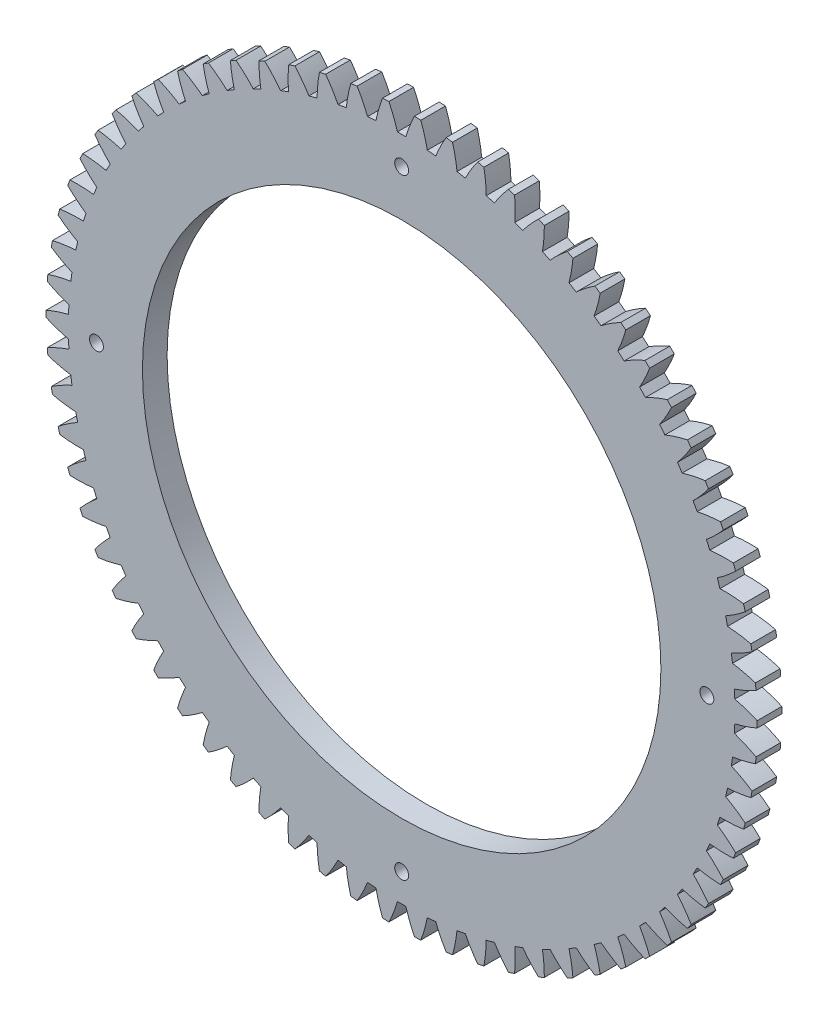
from build123d import *

# Parameters (mm, degrees)
SKETCH1_R           = 1.7859375
SKETCH1_R_2         = 66.675
BOSS_EXTRUDE1_DEPTH = 6.35


with BuildPart() as part:
    # Sketch1 → Boss-Extrude1 (new body)
    with BuildSketch(Plane.XY):
        with BuildLine():
            ThreePointArc((-91.436313371, -0.821095041), (-88.599272387, -1.913246534), (-85.679316616, -2.759092107))
            ThreePointArc((-85.679316616, -2.759092107), (-85.637411908, -3.845980603), (-85.581719987, -4.932249915))
            ThreePointArc((-85.581719987, -4.932249915), (-88.414099861, -6.03643318), (-91.141820048, -7.378498385))
            ThreePointArc((-91.141820048, -7.378498385), (-91.071889443, -8.196618406), (-90.994615263, -9.014077493))
            ThreePointArc((-90.994615263, -9.014077493), (-88.071095667, -9.847521912), (-85.087073767, -10.428219542))
            ThreePointArc((-85.087073767, -10.428219542), (-84.947909821, -11.506976236), (-84.795069669, -12.583880362))
            ThreePointArc((-84.795069669, -12.583880362), (-87.51706899, -13.937511083), (-90.113506379, -15.518684481))
            ThreePointArc((-90.113506379, -15.518684481), (-89.970521581, -16.32724246), (-89.820282017, -17.134483894))
            ThreePointArc((-89.820282017, -17.134483894), (-86.833822269, -17.702510834), (-83.809759831, -18.013385085))
            ThreePointArc((-83.809759831, -18.013385085), (-83.574457113, -19.075324462), (-83.325699309, -20.134192802))
            ThreePointArc((-83.325699309, -20.134192802), (-85.915402138, -21.726372343), (-88.359651744, -23.533923255))
            ThreePointArc((-88.359651744, -23.533923255), (-88.144763982, -24.326409159), (-87.922768674, -25.116933505))
            ThreePointArc((-87.922768674, -25.116933505), (-84.897413993, -25.414969548), (-81.857658987, -25.453517444))
            ThreePointArc((-81.857658987, -25.453517444), (-81.528112018, -26.490089391), (-81.185439413, -27.522396561))
            ThreePointArc((-81.185439413, -27.522396561), (-83.621994986, -29.340305627), (-85.894377147, -31.359680716))
            ThreePointArc((-85.894377147, -31.359680716), (-85.609316571, -32.129713914), (-85.317352895, -32.897156335))
            ThreePointArc((-85.317352895, -32.897156335), (-82.277461657, -32.92280187), (-79.246488405, -32.688713046))
            ThreePointArc((-79.246488405, -32.688713046), (-78.825350502, -33.691571697), (-78.391522095, -34.689006166))
            ThreePointArc((-78.391522095, -34.689006166), (-80.655312699, -36.718008022), (-82.73753153, -38.932948467))
            ThreePointArc((-82.73753153, -38.932948467), (-82.384593281, -39.674329105), (-82.025011957, -40.412510607))
            ThreePointArc((-82.025011957, -40.412510607), (-78.995059579, -40.16555915), (-75.997271695, -39.660718351))
            ThreePointArc((-75.997271695, -39.660718351), (-75.487933612, -40.621789277), (-74.966442334, -41.57632029))
            ThreePointArc((-74.966442334, -41.57632029), (-77.039241259, -43.800078607), (-78.914531958, -46.192751009))
            ThreePointArc((-78.914531958, -46.192751009), (-78.496557687, -46.899509926), (-78.072253852, -47.602487105))
            ThreePointArc((-78.072253852, -47.602487105), (-75.076635729, -47.084926965), (-72.136169638, -46.313398872))
            ThreePointArc((-72.136169638, -46.313398872), (-71.542732267, -47.224944096), (-70.937776859, -48.12888633))
            ThreePointArc((-70.937776859, -48.12888633), (-72.802895147, -50.529496712), (-74.456158976, -53.080636681))
            ThreePointArc((-74.456158976, -53.080636681), (-73.976513966, -53.74708347), (-73.490903864, -54.409196366))
            ThreePointArc((-73.490903864, -54.409196366), (-70.553738953, -53.625194633), (-67.694269559, -52.593191137))
            ThreePointArc((-67.694269559, -52.593191137), (-67.021510909, -53.447871432), (-66.337962116, -54.293946876))
            ThreePointArc((-66.337962116, -54.293946876), (-67.98038293, -56.852081021), (-69.398308782, -59.541148278))
            ThreePointArc((-69.398308782, -59.541148278), (-68.860854851, -60.1619171), (-68.317848331, -60.777834771))
            ThreePointArc((-68.317848331, -60.777834771), (-65.462784956, -59.733703766), (-62.707335025, -58.449533952))
            ThreePointArc((-62.707335025, -58.449533952), (-61.960671752, -59.240467935), (-61.204033108, -60.021864486))
            ThreePointArc((-61.204033108, -60.021864486), (-62.610532642, -62.716925802), (-63.781704211, -65.522269558))
            ThreePointArc((-63.781704211, -65.522269558), (-63.190768623, -66.092362348), (-62.594737653, -66.657125786))
            ThreePointArc((-62.594737653, -66.657125786), (-59.844763106, -65.361272238), (-57.2155179, -63.835275487))
            ThreePointArc((-57.2155179, -63.835275487), (-56.400961699, -64.556095022), (-55.577325213, -65.266521336))
            ThreePointArc((-55.577325213, -65.266521336), (-56.736579159, -68.076810773), (-57.65156686, -70.97584405))
            ThreePointArc((-57.65156686, -70.97584405), (-57.011907482, -71.490670757), (-56.367650953, -71.999732819))
            ThreePointArc((-56.367650953, -71.999732819), (-53.744906411, -70.462590178), (-51.263035068, -68.707052918))
            ThreePointArc((-51.263035068, -68.707052918), (-50.387144266, -69.351954391), (-49.503141374, -69.985690532))
            ThreePointArc((-49.503141374, -69.985690532), (-50.405816102, -72.888581292), (-51.057252992, -75.857962779))
            ThreePointArc((-51.057252992, -75.857962779), (-50.374019984, -76.31337832), (-49.686725071, -76.762640338))
            ThreePointArc((-49.686725071, -76.762640338), (-47.212327331, -74.996584773), (-44.89781242, -73.025641559))
            ThreePointArc((-44.89781242, -73.025641559), (-43.967639174, -73.589432602), (-43.030387348, -74.141376098))
            ThreePointArc((-43.030387348, -74.141376098), (-43.669215051, -77.113495813), (-44.051856143, -80.129317795))
            ThreePointArc((-44.051856143, -80.129317795), (-43.330550497, -80.521655433), (-42.605750894, -80.907500213))
            ThreePointArc((-42.605750894, -80.907500213), (-40.299622352, -78.926750966), (-38.171098985, -76.756270671))
            ThreePointArc((-38.171098985, -76.756270671), (-37.194132504, -77.23441197), (-36.211177945, -77.700118899))
            ThreePointArc((-36.211177945, -77.700118899), (-36.581015158, -80.717537808), (-36.691779652, -83.75551866))
            ThreePointArc((-36.691779652, -83.75551866), (-35.938208894, -84.081619522), (-35.181740263, -84.400940469))
            ThreePointArc((-35.181740263, -84.400940469), (-33.06244851, -82.221445367), (-31.137054306, -79.868903425))
            ThreePointArc((-31.137054306, -79.868903425), (-30.121160548, -80.257545267), (-29.100417429, -80.63326603))
            ThreePointArc((-29.100417429, -80.63326603), (-29.19828644, -83.671689649), (-29.036282524, -86.707369336))
            ThreePointArc((-29.036282524, -86.707369336), (-28.256513966, -86.96460785), (-27.474466945, -87.21483398))
            ThreePointArc((-27.474466945, -87.21483398), (-25.559075273, -84.854141036), (-23.852312373, -82.33847873))
            ThreePointArc((-23.852312373, -82.33847873), (-22.805670719, -82.634492), (-21.755357462, -82.917201513))
            ThreePointArc((-21.755357462, -82.917201513), (-21.580470288, -85.952166243), (-21.147002323, -88.961103257))
            ThreePointArc((-21.147002323, -88.961103257), (-20.347314201, -89.14740829), (-19.545985374, -89.326524928))
            ThreePointArc((-19.545985374, -89.326524928), (-17.84991539, -86.803641054), (-16.375525647, -84.145113019))
            ThreePointArc((-16.375525647, -84.145113019), (-15.306563039, -84.346114392), (-14.235136149, -84.533536445))
            ThreePointArc((-14.235136149, -84.533536445), (-13.788900879, -87.540606534), (-13.087458894, -90.498574683))
            ThreePointArc((-13.087458894, -90.498574683), (-12.274289826, -90.612446216), (-11.460131023, -90.719011221))
            ThreePointArc((-11.460131023, -90.719011221), (-9.997038484, -88.054249195), (-8.766892816, -85.274260334))
            ThreePointArc((-8.766892816, -85.274260334), (-7.684215914, -85.378631465), (-6.60030189, -85.469257046))
            ThreePointArc((-6.60030189, -85.469257046), (-5.886311347, -88.424221334), (-4.922542941, -91.307404798))
            ThreePointArc((-4.922542941, -91.307404798), (-4.102440087, -91.347926005), (-3.282006434, -91.381081378))
            ThreePointArc((-3.282006434, -91.381081378), (-2.063671302, -88.595896296), (-1.08767412, -85.716829445))
            ThreePointArc((-1.08767412, -85.716829445), (0, -85.72373), (1.08767412, -85.716829445))
            ThreePointArc((1.08767412, -85.716829445), (2.063671302, -88.595896296), (3.282006434, -91.381081378))
            ThreePointArc((3.282006434, -91.381081378), (4.102440087, -91.347926005), (4.922542941, -91.307404798))
            ThreePointArc((4.922542941, -91.307404798), (5.886311347, -88.424221334), (6.60030189, -85.469257046))
            ThreePointArc((6.60030189, -85.469257046), (7.684215914, -85.378631465), (8.766892816, -85.274260334))
            ThreePointArc((8.766892816, -85.274260334), (9.997038484, -88.054249195), (11.460131023, -90.719011221))
            ThreePointArc((11.460131023, -90.719011221), (12.274289826, -90.612446216), (13.087458894, -90.498574683))
            ThreePointArc((13.087458894, -90.498574683), (13.788900879, -87.540606534), (14.235136149, -84.533536445))
            ThreePointArc((14.235136149, -84.533536445), (15.306563039, -84.346114392), (16.375525647, -84.145113019))
            ThreePointArc((16.375525647, -84.145113019), (17.84991539, -86.803641054), (19.545985375, -89.326524928))
            ThreePointArc((19.545985375, -89.326524928), (20.347314201, -89.14740829), (21.147002323, -88.961103257))
            ThreePointArc((21.147002323, -88.961103257), (21.580470288, -85.952166243), (21.755357462, -82.917201513))
            ThreePointArc((21.755357462, -82.917201513), (22.805670719, -82.634492), (23.852312373, -82.33847873))
            ThreePointArc((23.852312373, -82.33847873), (25.559075273, -84.854141036), (27.474466945, -87.21483398))
            ThreePointArc((27.474466945, -87.21483398), (28.256513966, -86.96460785), (29.036282524, -86.707369336))
            ThreePointArc((29.036282524, -86.707369336), (29.19828644, -83.671689649), (29.100417429, -80.63326603))
            ThreePointArc((29.100417429, -80.63326603), (30.121160548, -80.257545267), (31.137054306, -79.868903425))
            ThreePointArc((31.137054306, -79.868903425), (33.06244851, -82.221445367), (35.181740263, -84.400940469))
            ThreePointArc((35.181740263, -84.400940469), (35.938208894, -84.081619522), (36.691779652, -83.75551866))
            ThreePointArc((36.691779652, -83.75551866), (36.581015158, -80.717537808), (36.211177945, -77.700118899))
            ThreePointArc((36.211177945, -77.700118899), (37.194132504, -77.23441197), (38.171098985, -76.756270671))
            ThreePointArc((38.171098985, -76.756270671), (40.299622352, -78.926750966), (42.605750894, -80.907500213))
            ThreePointArc((42.605750894, -80.907500213), (43.330550497, -80.521655433), (44.051856143, -80.129317795))
            ThreePointArc((44.051856143, -80.129317795), (43.669215051, -77.113495813), (43.030387348, -74.141376098))
            ThreePointArc((43.030387348, -74.141376098), (43.967639174, -73.589432602), (44.89781242, -73.025641559))
            ThreePointArc((44.89781242, -73.025641559), (47.212327331, -74.996584773), (49.686725071, -76.762640338))
            ThreePointArc((49.686725071, -76.762640338), (50.374019984, -76.31337832), (51.057252992, -75.857962779))
            ThreePointArc((51.057252992, -75.857962779), (50.405816102, -72.888581292), (49.503141374, -69.985690532))
            ThreePointArc((49.503141374, -69.985690532), (50.387144266, -69.351954391), (51.263035068, -68.707052918))
            ThreePointArc((51.263035068, -68.707052918), (53.744906411, -70.462590178), (56.367650953, -71.999732819))
            ThreePointArc((56.367650953, -71.999732819), (57.011907482, -71.490670757), (57.65156686, -70.97584405))
            ThreePointArc((57.65156686, -70.97584405), (56.736579159, -68.076810773), (55.577325213, -65.266521336))
            ThreePointArc((55.577325213, -65.266521336), (56.400961699, -64.556095022), (57.2155179, -63.835275487))
            ThreePointArc((57.2155179, -63.835275487), (59.844763106, -65.361272238), (62.594737653, -66.657125786))
            ThreePointArc((62.594737653, -66.657125786), (63.190768623, -66.092362348), (63.781704211, -65.522269558))
            ThreePointArc((63.781704211, -65.522269558), (62.610532642, -62.716925802), (61.204033108, -60.021864486))
            ThreePointArc((61.204033108, -60.021864486), (61.960671752, -59.240467935), (62.707335025, -58.449533952))
            ThreePointArc((62.707335025, -58.449533952), (65.462784956, -59.733703766), (68.317848331, -60.777834771))
            ThreePointArc((68.317848331, -60.777834771), (68.860854851, -60.1619171), (69.398308782, -59.541148278))
            ThreePointArc((69.398308782, -59.541148278), (67.98038293, -56.852081021), (66.337962116, -54.293946876))
            ThreePointArc((66.337962116, -54.293946876), (67.021510909, -53.447871432), (67.694269559, -52.593191137))
            ThreePointArc((67.694269559, -52.593191137), (70.553738953, -53.625194633), (73.490903864, -54.409196366))
            ThreePointArc((73.490903864, -54.409196366), (73.976513966, -53.74708347), (74.456158976, -53.080636681))
            ThreePointArc((74.456158976, -53.080636681), (72.802895147, -50.529496712), (70.937776859, -48.12888633))
            ThreePointArc((70.937776859, -48.12888633), (71.542732267, -47.224944096), (72.136169638, -46.313398872))
            ThreePointArc((72.136169638, -46.313398872), (75.076635729, -47.084926965), (78.072253852, -47.602487105))
            ThreePointArc((78.072253852, -47.602487105), (78.496557687, -46.899509926), (78.914531958, -46.192751009))
            ThreePointArc((78.914531958, -46.192751009), (77.039241259, -43.800078607), (74.966442334, -41.57632029))
            ThreePointArc((74.966442334, -41.57632029), (75.487933612, -40.621789277), (75.997271695, -39.660718351))
            ThreePointArc((75.997271695, -39.660718351), (78.995059579, -40.16555915), (82.025011957, -40.412510607))
            ThreePointArc((82.025011957, -40.412510607), (82.384593281, -39.674329105), (82.73753153, -38.932948467))
            ThreePointArc((82.73753153, -38.932948467), (80.655312699, -36.718008022), (78.391522095, -34.689006166))
            ThreePointArc((78.391522095, -34.689006166), (78.825350502, -33.691571697), (79.246488405, -32.688713046))
            ThreePointArc((79.246488405, -32.688713046), (82.277461657, -32.92280187), (85.317352895, -32.897156335))
            ThreePointArc((85.317352895, -32.897156335), (85.609316571, -32.129713914), (85.894377147, -31.359680716))
            ThreePointArc((85.894377147, -31.359680716), (83.621994986, -29.340305627), (81.185439413, -27.522396561))
            ThreePointArc((81.185439413, -27.522396561), (81.528112018, -26.490089391), (81.857658987, -25.453517444))
            ThreePointArc((81.857658987, -25.453517444), (84.897413993, -25.414969548), (87.922768674, -25.116933505))
            ThreePointArc((87.922768674, -25.116933505), (88.144763982, -24.326409159), (88.359651744, -23.533923255))
            ThreePointArc((88.359651744, -23.533923255), (85.915402138, -21.726372343), (83.325699309, -20.134192802))
            ThreePointArc((83.325699309, -20.134192802), (83.574457113, -19.075324462), (83.809759831, -18.013385085))
            ThreePointArc((83.809759831, -18.013385085), (86.833822269, -17.702510834), (89.820282017, -17.134483894))
            ThreePointArc((89.820282017, -17.134483894), (89.970521581, -16.32724246), (90.113506379, -15.518684481))
            ThreePointArc((90.113506379, -15.518684481), (87.51706899, -13.937511083), (84.795069669, -12.583880362))
            ThreePointArc((84.795069669, -12.583880362), (84.947909821, -11.506976236), (85.087073767, -10.428219542))
            ThreePointArc((85.087073767, -10.428219542), (88.071095667, -9.847521912), (90.994615263, -9.014077493))
            ThreePointArc((90.994615263, -9.014077493), (91.071889443, -8.196618406), (91.141820048, -7.378498385))
            ThreePointArc((91.141820048, -7.378498385), (88.414099861, -6.03643318), (85.581719987, -4.932249915))
            ThreePointArc((85.581719987, -4.932249915), (85.637411908, -3.845980603), (85.679316616, -2.759092107))
            ThreePointArc((85.679316616, -2.759092107), (88.599272387, -1.913246534), (91.436313371, -0.821095041))
            ThreePointArc((91.436313371, -0.821095041), (91.44, 0), (91.436313371, 0.821095041))
            ThreePointArc((91.436313371, 0.821095041), (88.599272387, 1.913246534), (85.679316616, 2.759092107))
            ThreePointArc((85.679316616, 2.759092107), (85.637411908, 3.845980603), (85.581719987, 4.932249915))
            ThreePointArc((85.581719987, 4.932249915), (88.414099861, 6.03643318), (91.141820048, 7.378498385))
            ThreePointArc((91.141820048, 7.378498385), (91.071889443, 8.196618406), (90.994615263, 9.014077493))
            ThreePointArc((90.994615263, 9.014077493), (88.071095667, 9.847521912), (85.087073767, 10.428219542))
            ThreePointArc((85.087073767, 10.428219542), (84.947909821, 11.506976236), (84.795069669, 12.583880362))
            ThreePointArc((84.795069669, 12.583880362), (87.51706899, 13.937511083), (90.113506379, 15.518684481))
            ThreePointArc((90.113506379, 15.518684481), (89.970521581, 16.32724246), (89.820282017, 17.134483894))
            ThreePointArc((89.820282017, 17.134483894), (86.833822269, 17.702510834), (83.809759831, 18.013385085))
            ThreePointArc((83.809759831, 18.013385085), (83.574457113, 19.075324462), (83.325699309, 20.134192802))
            ThreePointArc((83.325699309, 20.134192802), (85.915402138, 21.726372343), (88.359651744, 23.533923255))
            ThreePointArc((88.359651744, 23.533923255), (88.144763982, 24.326409159), (87.922768674, 25.116933505))
            ThreePointArc((87.922768674, 25.116933505), (84.897413993, 25.414969548), (81.857658987, 25.453517444))
            ThreePointArc((81.857658987, 25.453517444), (81.528112018, 26.490089391), (81.185439413, 27.522396561))
            ThreePointArc((81.185439413, 27.522396561), (83.621994986, 29.340305627), (85.894377147, 31.359680716))
            ThreePointArc((85.894377147, 31.359680716), (85.609316571, 32.129713914), (85.317352895, 32.897156335))
            ThreePointArc((85.317352895, 32.897156335), (82.277461657, 32.92280187), (79.246488405, 32.688713046))
            ThreePointArc((79.246488405, 32.688713046), (78.825350502, 33.691571697), (78.391522095, 34.689006166))
            ThreePointArc((78.391522095, 34.689006166), (80.655312699, 36.718008022), (82.73753153, 38.932948467))
            ThreePointArc((82.73753153, 38.932948467), (82.384593281, 39.674329105), (82.025011957, 40.412510607))
            ThreePointArc((82.025011957, 40.412510607), (78.995059579, 40.16555915), (75.997271695, 39.660718351))
            ThreePointArc((75.997271695, 39.660718351), (75.487933612, 40.621789277), (74.966442334, 41.57632029))
            ThreePointArc((74.966442334, 41.57632029), (77.039241259, 43.800078607), (78.914531958, 46.192751009))
            ThreePointArc((78.914531958, 46.192751009), (78.496557687, 46.899509926), (78.072253852, 47.602487105))
            ThreePointArc((78.072253852, 47.602487105), (75.076635729, 47.084926965), (72.136169638, 46.313398872))
            ThreePointArc((72.136169638, 46.313398872), (71.542732267, 47.224944096), (70.937776859, 48.12888633))
            ThreePointArc((70.937776859, 48.12888633), (72.802895147, 50.529496712), (74.456158976, 53.080636681))
            ThreePointArc((74.456158976, 53.080636681), (73.976513966, 53.74708347), (73.490903864, 54.409196366))
            ThreePointArc((73.490903864, 54.409196366), (70.553738953, 53.625194633), (67.694269559, 52.593191137))
            ThreePointArc((67.694269559, 52.593191137), (67.021510909, 53.447871432), (66.337962116, 54.293946876))
            ThreePointArc((66.337962116, 54.293946876), (67.98038293, 56.852081021), (69.398308782, 59.541148278))
            ThreePointArc((69.398308782, 59.541148278), (68.860854851, 60.1619171), (68.317848331, 60.777834771))
            ThreePointArc((68.317848331, 60.777834771), (65.462784956, 59.733703766), (62.707335025, 58.449533952))
            ThreePointArc((62.707335025, 58.449533952), (61.960671752, 59.240467935), (61.204033108, 60.021864486))
            ThreePointArc((61.204033108, 60.021864486), (62.610532642, 62.716925802), (63.781704211, 65.522269558))
            ThreePointArc((63.781704211, 65.522269558), (63.190768623, 66.092362348), (62.594737653, 66.657125786))
            ThreePointArc((62.594737653, 66.657125786), (59.844763106, 65.361272238), (57.2155179, 63.835275487))
            ThreePointArc((57.2155179, 63.835275487), (56.400961699, 64.556095022), (55.577325213, 65.266521336))
            ThreePointArc((55.577325213, 65.266521336), (56.736579159, 68.076810773), (57.65156686, 70.97584405))
            ThreePointArc((57.65156686, 70.97584405), (57.011907482, 71.490670757), (56.367650953, 71.999732819))
            ThreePointArc((56.367650953, 71.999732819), (53.744906411, 70.462590178), (51.263035068, 68.707052918))
            ThreePointArc((51.263035068, 68.707052918), (50.387144266, 69.351954391), (49.503141374, 69.985690532))
            ThreePointArc((49.503141374, 69.985690532), (50.405816102, 72.888581292), (51.057252992, 75.857962779))
            ThreePointArc((51.057252992, 75.857962779), (50.374019984, 76.31337832), (49.686725071, 76.762640338))
            ThreePointArc((49.686725071, 76.762640338), (47.212327331, 74.996584773), (44.89781242, 73.025641559))
            ThreePointArc((44.89781242, 73.025641559), (43.967639174, 73.589432602), (43.030387348, 74.141376098))
            ThreePointArc((43.030387348, 74.141376098), (43.669215051, 77.113495813), (44.051856143, 80.129317795))
            ThreePointArc((44.051856143, 80.129317795), (43.330550497, 80.521655433), (42.605750894, 80.907500213))
            ThreePointArc((42.605750894, 80.907500213), (40.299622352, 78.926750966), (38.171098985, 76.756270671))
            ThreePointArc((38.171098985, 76.756270671), (37.194132504, 77.23441197), (36.211177945, 77.700118899))
            ThreePointArc((36.211177945, 77.700118899), (36.581015158, 80.717537808), (36.691779652, 83.75551866))
            ThreePointArc((36.691779652, 83.75551866), (35.938208894, 84.081619522), (35.181740263, 84.400940469))
            ThreePointArc((35.181740263, 84.400940469), (33.06244851, 82.221445367), (31.137054306, 79.868903425))
            ThreePointArc((31.137054306, 79.868903425), (30.121160548, 80.257545267), (29.100417429, 80.63326603))
            ThreePointArc((29.100417429, 80.63326603), (29.19828644, 83.671689649), (29.036282524, 86.707369336))
            ThreePointArc((29.036282524, 86.707369336), (28.256513966, 86.96460785), (27.474466945, 87.21483398))
            ThreePointArc((27.474466945, 87.21483398), (25.559075273, 84.854141036), (23.852312373, 82.33847873))
            ThreePointArc((23.852312373, 82.33847873), (22.805670719, 82.634492), (21.755357462, 82.917201513))
            ThreePointArc((21.755357462, 82.917201513), (21.580470288, 85.952166243), (21.147002323, 88.961103257))
            ThreePointArc((21.147002323, 88.961103257), (20.347314201, 89.14740829), (19.545985374, 89.326524928))
            ThreePointArc((19.545985374, 89.326524928), (17.84991539, 86.803641054), (16.375525647, 84.145113019))
            ThreePointArc((16.375525647, 84.145113019), (15.306563039, 84.346114392), (14.235136149, 84.533536445))
            ThreePointArc((14.235136149, 84.533536445), (13.788900879, 87.540606534), (13.087458894, 90.498574683))
            ThreePointArc((13.087458894, 90.498574683), (12.274289826, 90.612446216), (11.460131023, 90.719011221))
            ThreePointArc((11.460131023, 90.719011221), (9.997038484, 88.054249195), (8.766892816, 85.274260334))
            ThreePointArc((8.766892816, 85.274260334), (7.684215914, 85.378631465), (6.60030189, 85.469257046))
            ThreePointArc((6.60030189, 85.469257046), (5.886311347, 88.424221334), (4.922542941, 91.307404798))
            ThreePointArc((4.922542941, 91.307404798), (4.102440087, 91.347926005), (3.282006434, 91.381081378))
            ThreePointArc((3.282006434, 91.381081378), (2.063671302, 88.595896296), (1.08767412, 85.716829445))
            ThreePointArc((1.08767412, 85.716829445), (0, 85.72373), (-1.08767412, 85.716829445))
            ThreePointArc((-1.08767412, 85.716829445), (-2.063671302, 88.595896296), (-3.282006434, 91.381081378))
            ThreePointArc((-3.282006434, 91.381081378), (-4.102440087, 91.347926005), (-4.922542941, 91.307404798))
            ThreePointArc((-4.922542941, 91.307404798), (-5.886311347, 88.424221334), (-6.60030189, 85.469257046))
            ThreePointArc((-6.60030189, 85.469257046), (-7.684215914, 85.378631465), (-8.766892816, 85.274260334))
            ThreePointArc((-8.766892816, 85.274260334), (-9.997038484, 88.054249195), (-11.460131023, 90.719011221))
            ThreePointArc((-11.460131023, 90.719011221), (-12.274289826, 90.612446216), (-13.087458894, 90.498574683))
            ThreePointArc((-13.087458894, 90.498574683), (-13.788900879, 87.540606534), (-14.235136149, 84.533536445))
            ThreePointArc((-14.235136149, 84.533536445), (-15.306563039, 84.346114392), (-16.375525647, 84.145113019))
            ThreePointArc((-16.375525647, 84.145113019), (-17.84991539, 86.803641054), (-19.545985375, 89.326524928))
            ThreePointArc((-19.545985375, 89.326524928), (-20.347314201, 89.14740829), (-21.147002323, 88.961103257))
            ThreePointArc((-21.147002323, 88.961103257), (-21.580470288, 85.952166243), (-21.755357462, 82.917201513))
            ThreePointArc((-21.755357462, 82.917201513), (-22.805670719, 82.634492), (-23.852312373, 82.33847873))
            ThreePointArc((-23.852312373, 82.33847873), (-25.559075273, 84.854141036), (-27.474466945, 87.21483398))
            ThreePointArc((-27.474466945, 87.21483398), (-28.256513966, 86.96460785), (-29.036282524, 86.707369336))
            ThreePointArc((-29.036282524, 86.707369336), (-29.19828644, 83.671689649), (-29.100417429, 80.63326603))
            ThreePointArc((-29.100417429, 80.63326603), (-30.121160548, 80.257545267), (-31.137054306, 79.868903425))
            ThreePointArc((-31.137054306, 79.868903425), (-33.06244851, 82.221445367), (-35.181740263, 84.400940469))
            ThreePointArc((-35.181740263, 84.400940469), (-35.938208894, 84.081619522), (-36.691779652, 83.75551866))
            ThreePointArc((-36.691779652, 83.75551866), (-36.581015158, 80.717537808), (-36.211177945, 77.700118899))
            ThreePointArc((-36.211177945, 77.700118899), (-37.194132504, 77.23441197), (-38.171098985, 76.756270671))
            ThreePointArc((-38.171098985, 76.756270671), (-40.299622352, 78.926750966), (-42.605750894, 80.907500213))
            ThreePointArc((-42.605750894, 80.907500213), (-43.330550497, 80.521655433), (-44.051856143, 80.129317795))
            ThreePointArc((-44.051856143, 80.129317795), (-43.669215051, 77.113495813), (-43.030387348, 74.141376098))
            ThreePointArc((-43.030387348, 74.141376098), (-43.967639174, 73.589432602), (-44.89781242, 73.025641559))
            ThreePointArc((-44.89781242, 73.025641559), (-47.212327331, 74.996584773), (-49.686725071, 76.762640338))
            ThreePointArc((-49.686725071, 76.762640338), (-50.374019984, 76.31337832), (-51.057252992, 75.857962779))
            ThreePointArc((-51.057252992, 75.857962779), (-50.405816102, 72.888581292), (-49.503141374, 69.985690532))
            ThreePointArc((-49.503141374, 69.985690532), (-50.387144266, 69.351954391), (-51.263035068, 68.707052918))
            ThreePointArc((-51.263035068, 68.707052918), (-53.744906411, 70.462590178), (-56.367650953, 71.999732819))
            ThreePointArc((-56.367650953, 71.999732819), (-57.011907482, 71.490670757), (-57.65156686, 70.97584405))
            ThreePointArc((-57.65156686, 70.97584405), (-56.736579159, 68.076810773), (-55.577325213, 65.266521336))
            ThreePointArc((-55.577325213, 65.266521336), (-56.400961699, 64.556095022), (-57.2155179, 63.835275487))
            ThreePointArc((-57.2155179, 63.835275487), (-59.844763106, 65.361272238), (-62.594737653, 66.657125786))
            ThreePointArc((-62.594737653, 66.657125786), (-63.190768623, 66.092362348), (-63.781704211, 65.522269558))
            ThreePointArc((-63.781704211, 65.522269558), (-62.610532642, 62.716925802), (-61.204033108, 60.021864486))
            ThreePointArc((-61.204033108, 60.021864486), (-61.960671752, 59.240467935), (-62.707335025, 58.449533952))
            ThreePointArc((-62.707335025, 58.449533952), (-65.462784956, 59.733703766), (-68.317848331, 60.777834771))
            ThreePointArc((-68.317848331, 60.777834771), (-68.860854851, 60.1619171), (-69.398308782, 59.541148278))
            ThreePointArc((-69.398308782, 59.541148278), (-67.98038293, 56.852081021), (-66.337962116, 54.293946876))
            ThreePointArc((-66.337962116, 54.293946876), (-67.021510909, 53.447871432), (-67.694269559, 52.593191137))
            ThreePointArc((-67.694269559, 52.593191137), (-70.553738953, 53.625194633), (-73.490903864, 54.409196366))
            ThreePointArc((-73.490903864, 54.409196366), (-73.976513966, 53.74708347), (-74.456158976, 53.080636681))
            ThreePointArc((-74.456158976, 53.080636681), (-72.802895147, 50.529496712), (-70.937776859, 48.12888633))
            ThreePointArc((-70.937776859, 48.12888633), (-71.542732267, 47.224944096), (-72.136169638, 46.313398872))
            ThreePointArc((-72.136169638, 46.313398872), (-75.076635729, 47.084926965), (-78.072253852, 47.602487105))
            ThreePointArc((-78.072253852, 47.602487105), (-78.496557687, 46.899509926), (-78.914531958, 46.192751009))
            ThreePointArc((-78.914531958, 46.192751009), (-77.039241259, 43.800078607), (-74.966442334, 41.57632029))
            ThreePointArc((-74.966442334, 41.57632029), (-75.487933612, 40.621789277), (-75.997271695, 39.660718351))
            ThreePointArc((-75.997271695, 39.660718351), (-78.995059579, 40.16555915), (-82.025011957, 40.412510607))
            ThreePointArc((-82.025011957, 40.412510607), (-82.384593281, 39.674329105), (-82.73753153, 38.932948467))
            ThreePointArc((-82.73753153, 38.932948467), (-80.655312699, 36.718008022), (-78.391522095, 34.689006166))
            ThreePointArc((-78.391522095, 34.689006166), (-78.825350502, 33.691571697), (-79.246488405, 32.688713046))
            ThreePointArc((-79.246488405, 32.688713046), (-82.277461657, 32.92280187), (-85.317352895, 32.897156335))
            ThreePointArc((-85.317352895, 32.897156335), (-85.609316571, 32.129713914), (-85.894377147, 31.359680716))
            ThreePointArc((-85.894377147, 31.359680716), (-83.621994986, 29.340305627), (-81.185439413, 27.522396561))
            ThreePointArc((-81.185439413, 27.522396561), (-81.528112018, 26.490089391), (-81.857658987, 25.453517444))
            ThreePointArc((-81.857658987, 25.453517444), (-84.897413993, 25.414969548), (-87.922768674, 25.116933505))
            ThreePointArc((-87.922768674, 25.116933505), (-88.144763982, 24.326409159), (-88.359651744, 23.533923255))
            ThreePointArc((-88.359651744, 23.533923255), (-85.915402138, 21.726372343), (-83.325699309, 20.134192802))
            ThreePointArc((-83.325699309, 20.134192802), (-83.574457113, 19.075324462), (-83.809759831, 18.013385085))
            ThreePointArc((-83.809759831, 18.013385085), (-86.833822269, 17.702510834), (-89.820282017, 17.134483894))
            ThreePointArc((-89.820282017, 17.134483894), (-89.970521581, 16.32724246), (-90.113506379, 15.518684481))
            ThreePointArc((-90.113506379, 15.518684481), (-87.51706899, 13.937511083), (-84.795069669, 12.583880362))
            ThreePointArc((-84.795069669, 12.583880362), (-84.947909821, 11.506976236), (-85.087073767, 10.428219542))
            ThreePointArc((-85.087073767, 10.428219542), (-88.071095667, 9.847521912), (-90.994615263, 9.014077493))
            ThreePointArc((-90.994615263, 9.014077493), (-91.071889443, 8.196618406), (-91.141820048, 7.378498385))
            ThreePointArc((-91.141820048, 7.378498385), (-88.414099861, 6.03643318), (-85.581719987, 4.932249915))
            ThreePointArc((-85.581719987, 4.932249915), (-85.637411908, 3.845980603), (-85.679316616, 2.759092107))
            ThreePointArc((-85.679316616, 2.759092107), (-88.599272387, 1.913246534), (-91.436313371, 0.821095041))
            ThreePointArc((-91.436313371, 0.821095041), (-91.44, 0), (-91.436313371, -0.821095041))
        make_face()
        with Locations((78.5, 0)):
            Circle(SKETCH1_R, mode=Mode.SUBTRACT)
        with Locations((0, -78.5)):
            Circle(SKETCH1_R, mode=Mode.SUBTRACT)
        Circle(SKETCH1_R_2, mode=Mode.SUBTRACT)
        with Locations((-78.5, 0)):
            Circle(SKETCH1_R, mode=Mode.SUBTRACT)
        with Locations((0, 78.5)):
            Circle(SKETCH1_R, mode=Mode.SUBTRACT)
    extrude(amount=BOSS_EXTRUDE1_DEPTH)


solid = part.part
